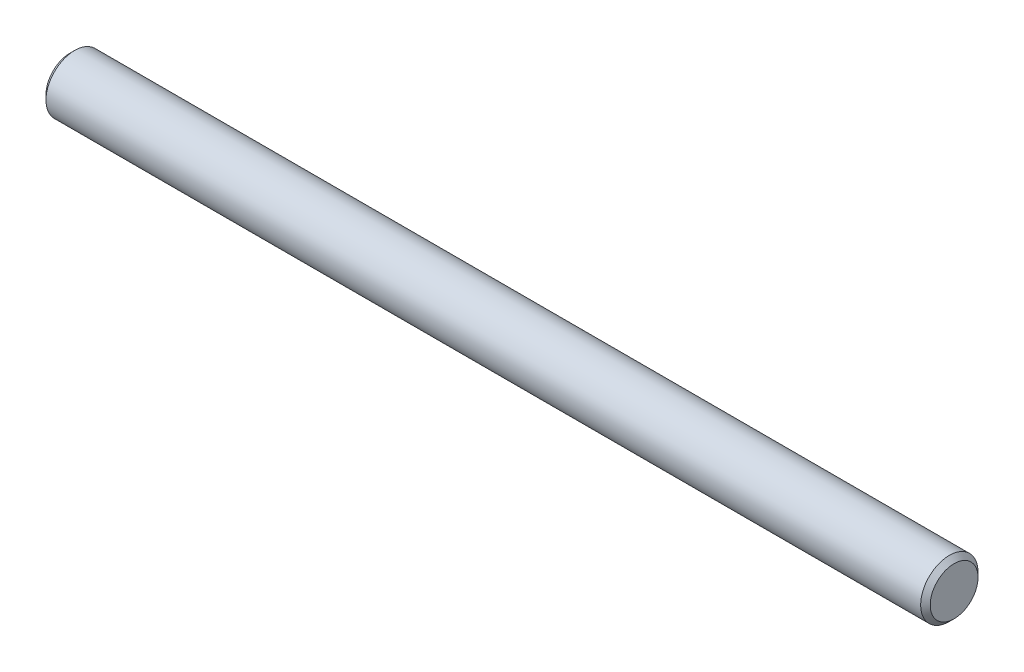
from build123d import *

# Parameters (mm, degrees)
SKETCH_1_W     = 185
SKETCH_1_H     = 6
CHAMFER_1_SIZE = 1


with BuildPart() as part:
    # Эскиз1 → Повернуть2 (revolve)
    with BuildSketch(Plane.XY, mode=Mode.PRIVATE) as revolve_2_sk:
        with Locations((92.5, -3)):
            Rectangle(SKETCH_1_W, SKETCH_1_H)
    revolve(revolve_2_sk.sketch.rotate(Axis((-265.537103045, 0, 0), (1, 0, 0)), 270), axis=Axis((-265.537103045, 0, 0), (1, 0, 0)))

    # Фаска1
    chamfer_1_edges = [part.edges().sort_by_distance(p)[0] for p in [
        (185, 0, -6),
        (0, 0, -6),
    ]]
    chamfer(chamfer_1_edges, length=CHAMFER_1_SIZE)


solid = part.part
